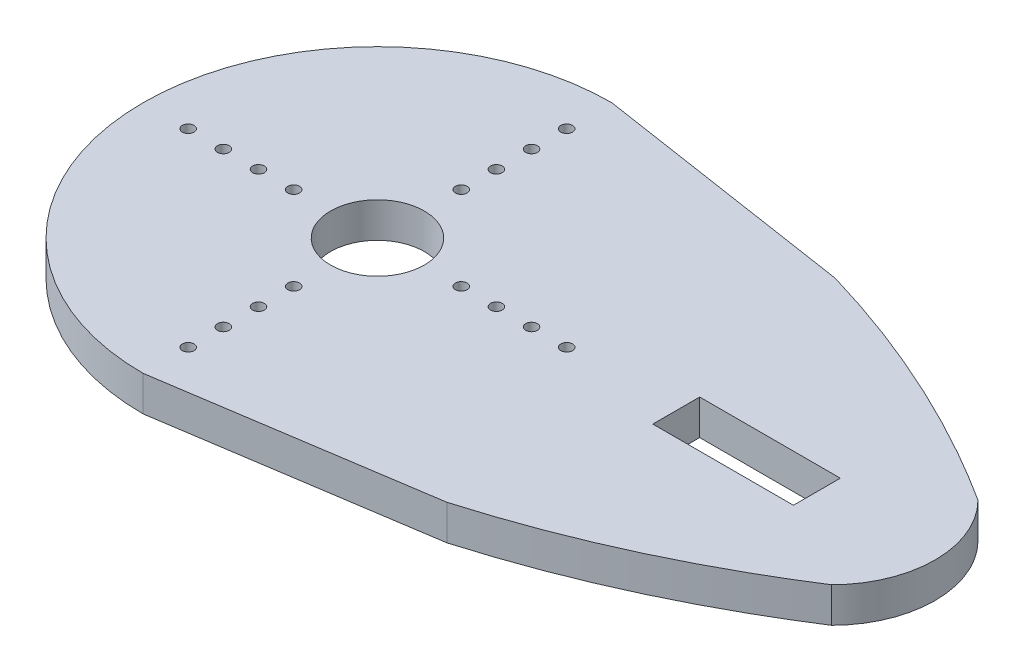
from build123d import *

# Parameters (mm, degrees)
SKETCH1_R           = 0.5
SKETCH1_R_2         = 4
SKETCH1_W           = 12
SKETCH1_H           = 4
BOSS_EXTRUDE1_DEPTH = 3


with BuildPart() as part:
    # Sketch1 → Boss-Extrude1 (new body)
    with BuildSketch(Plane(origin=(0, 0, 0), x_dir=(1, 0, 0), z_dir=(0, 1, 0))):
        with BuildLine():
            add(Edge.make_bspline(
                [(22.5, -16.5625), (34.262295129, -13.118708317), (45, -6.25)],
                knots=[0.479061635, 0.479061635, 0.479061635, 1, 1, 1], degree=2))
            ThreePointArc((45, -6.25), (47.588834765, 0), (45, 6.25))
            add(Edge.make_bspline(
                [(22.5, 16.5625), (34.262295129, 13.118708317), (45, 6.25)],
                knots=[0.479061635, 0.479061635, 0.479061635, 1, 1, 1], degree=2))
            Line((22.5, 16.5625), (0, 20))
            ThreePointArc((0, 20), (-20, 0), (0, -20))
            Line((0, -20), (22.5, -16.5625))
        make_face()
        with Locations(Location((0, -16.15, 0), (0, 0, 270))):
            Circle(SKETCH1_R, mode=Mode.SUBTRACT)
        with Locations(Location((0, -13.15, 0), (0, 0, 270))):
            Circle(SKETCH1_R, mode=Mode.SUBTRACT)
        with Locations(Location((0, -10.15, 0), (0, 0, 270))):
            Circle(SKETCH1_R, mode=Mode.SUBTRACT)
        with Locations(Location((-16.15, 0, 0), (0, 0, 270))):
            Circle(SKETCH1_R, mode=Mode.SUBTRACT)
        with BuildLine():
            ThreePointArc((-13.65, 0), (-13.15, 0.5), (-12.65, 0))
            ThreePointArc((-12.65, 0), (-13.15, -0.5), (-13.65, 0))
        make_face(mode=Mode.SUBTRACT)
        with BuildLine():
            ThreePointArc((-10.65, 0), (-10.15, 0.5), (-9.65, 0))
            ThreePointArc((-9.65, 0), (-10.15, -0.5), (-10.65, 0))
        make_face(mode=Mode.SUBTRACT)
        with BuildLine():
            ThreePointArc((-7.65, 0), (-7.15, 0.5), (-6.65, 0))
            ThreePointArc((-6.65, 0), (-7.15, -0.5), (-7.65, 0))
        make_face(mode=Mode.SUBTRACT)
        with Locations(Location((0, -7.15, 0), (0, 0, 270))):
            Circle(SKETCH1_R, mode=Mode.SUBTRACT)
        with Locations(Location((0, 0, 0), (0, 0, 270))):
            Circle(SKETCH1_R_2, mode=Mode.SUBTRACT)
        with Locations(Location((7.15, 0, 0), (0, 0, 270))):
            Circle(SKETCH1_R, mode=Mode.SUBTRACT)
        with Locations(Location((10.15, 0, 0), (0, 0, 270))):
            Circle(SKETCH1_R, mode=Mode.SUBTRACT)
        with Locations(Location((13.15, 0, 0), (0, 0, 270))):
            Circle(SKETCH1_R, mode=Mode.SUBTRACT)
        with Locations(Location((16.15, 0, 0), (0, 0, 270))):
            Circle(SKETCH1_R, mode=Mode.SUBTRACT)
        with Locations(Location((0, 7.15, 0), (0, 0, 270))):
            Circle(SKETCH1_R, mode=Mode.SUBTRACT)
        with Locations(Location((0, 10.15, 0), (0, 0, 270))):
            Circle(SKETCH1_R, mode=Mode.SUBTRACT)
        with Locations(Location((0, 13.15, 0), (0, 0, 270))):
            Circle(SKETCH1_R, mode=Mode.SUBTRACT)
        with Locations(Location((0, 16.15, 0), (0, 0, 270))):
            Circle(SKETCH1_R, mode=Mode.SUBTRACT)
        with Locations((31.5, 0)):
            Rectangle(SKETCH1_W, SKETCH1_H, mode=Mode.SUBTRACT)
    extrude(amount=BOSS_EXTRUDE1_DEPTH)


solid = part.part
